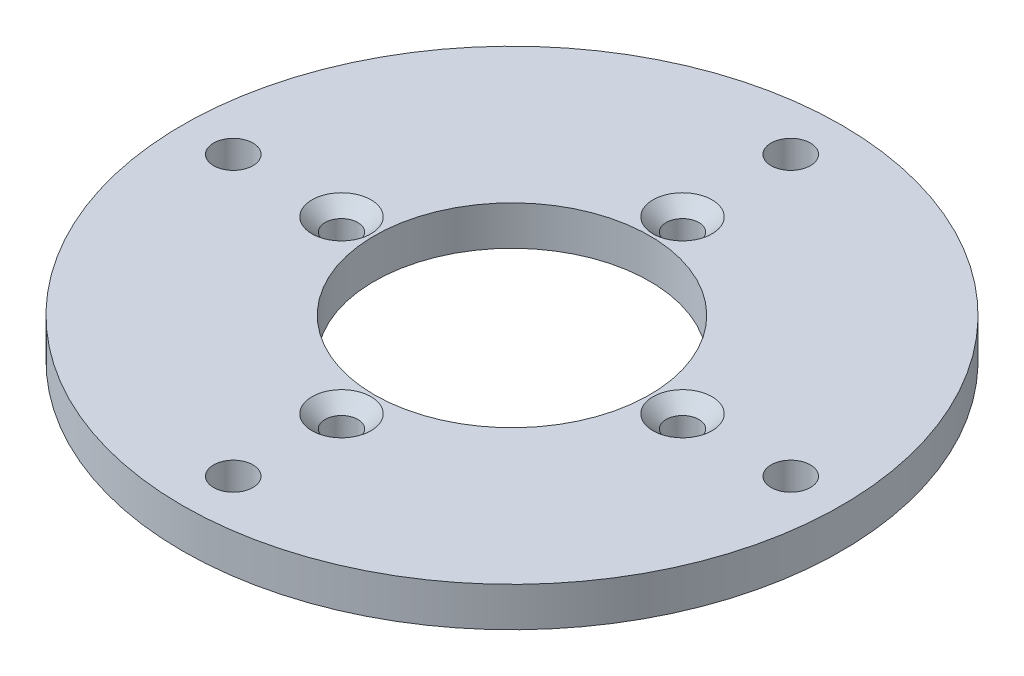
from build123d import *

# Parameters (mm, degrees)
SKETCH_1_R          = 50.25
SKETCH_1_R_2        = 21
EXTRUDE_1_DEPTH     = 6
SKETCH_2_R          = 2.5
CUT_EXTRUDE_1_DEPTH = 6
SKETCH_3_R          = 3
CUT_EXTRUDE_2_DEPTH = 10
CHAMFER_1_SIZE      = 2


with BuildPart() as part:
    # Эскиз1 → Бобышка-Вытянуть1 (new body)
    with BuildSketch(Plane(origin=(0, 0, 0), x_dir=(1, 0, 0), z_dir=(0, 1, 0))):
        with Locations(Location((0, 0, 0), (0, 0, 270))):
            Circle(SKETCH_1_R)
        with Locations(Location((0, 0, 0), (0, 0, 270))):
            Circle(SKETCH_1_R_2, mode=Mode.SUBTRACT)
    extrude(amount=EXTRUDE_1_DEPTH)

    # Эскиз2 → Вырез-Вытянуть1 (cut)
    with BuildSketch(Plane(origin=(0, 6, 0), x_dir=(1, 0, 0), z_dir=(0, 1, 0))):
        with Locations(Location((0, 26, 0), (0, 0, 270))):
            Circle(SKETCH_2_R)
        with Locations(Location((-26, 0, 0), (0, 0, 270))):
            Circle(SKETCH_2_R)
        with Locations(Location((26, 0, 0), (0, 0, 270))):
            Circle(SKETCH_2_R)
        with Locations(Location((0, -26, 0), (0, 0, 270))):
            Circle(SKETCH_2_R)
    extrude(amount=-CUT_EXTRUDE_1_DEPTH, mode=Mode.SUBTRACT)

    # Эскиз3 → Вырез-Вытянуть2 (cut)
    with BuildSketch(Plane(origin=(0, 6, 0), x_dir=(1, 0, 0), z_dir=(0, 1, 0))):
        with Locations(Location((-42.5, 0, 0), (0, 0, 270))):
            Circle(SKETCH_3_R)
        with Locations(Location((0, 42.5, 0), (0, 0, 270))):
            Circle(SKETCH_3_R)
        with Locations(Location((42.5, 0, 0), (0, 0, 270))):
            Circle(SKETCH_3_R)
        with Locations(Location((0, -42.5, 0), (0, 0, 270))):
            Circle(SKETCH_3_R)
    extrude(amount=-CUT_EXTRUDE_2_DEPTH, mode=Mode.SUBTRACT)

    # Фаска1
    chamfer_1_edges = [part.edges().sort_by_distance(p)[0] for p in [
        (0, 6, -28.5),
        (-26, 6, -2.5),
        (26, 6, -2.5),
        (0, 6, 23.5),
    ]]
    chamfer(chamfer_1_edges, length=CHAMFER_1_SIZE)


solid = part.part
